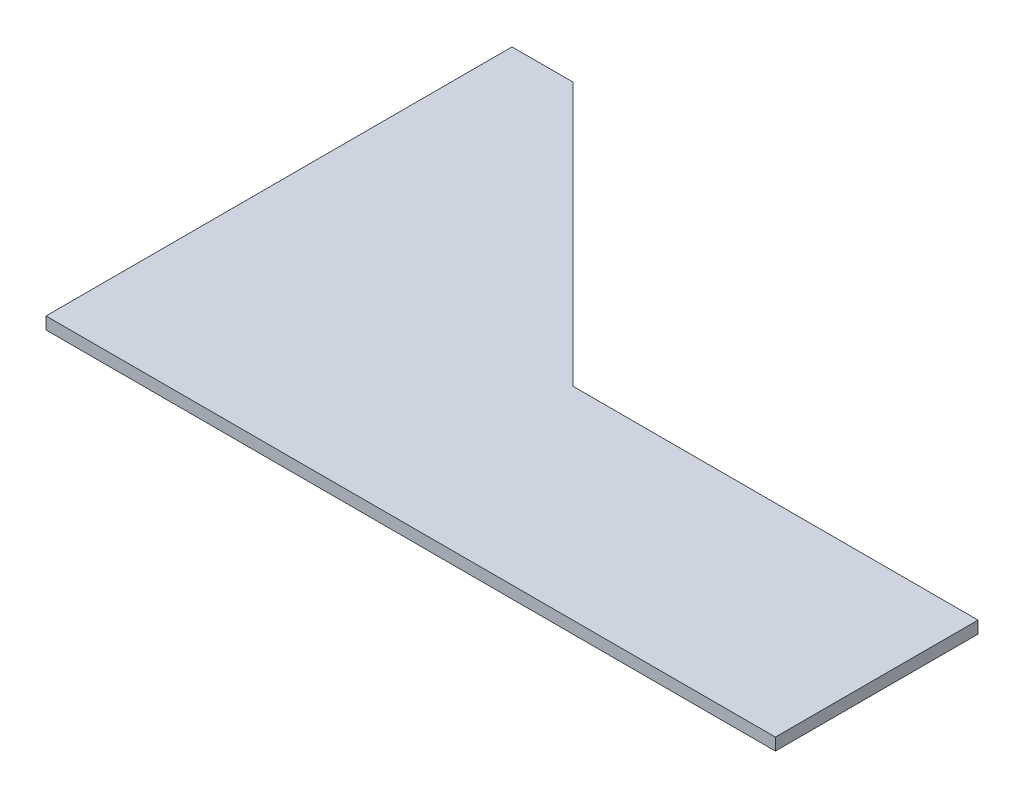
from build123d import *

# Parameters (mm, degrees)
RESSALTO_EXTRUS_O2_DEPTH = 6


with BuildPart() as part:
    # Esboço1 → Ressalto-extrusão2 (new body)
    with BuildSketch(Plane(origin=(0, 0, 0), x_dir=(1, 0, 0), z_dir=(0, 1, 0))):
        Polygon((0, 0), (0, 230), (30, 230), (160, 100), (360, 100), (360, 0), align=None)
    extrude(amount=RESSALTO_EXTRUS_O2_DEPTH)


solid = part.part
